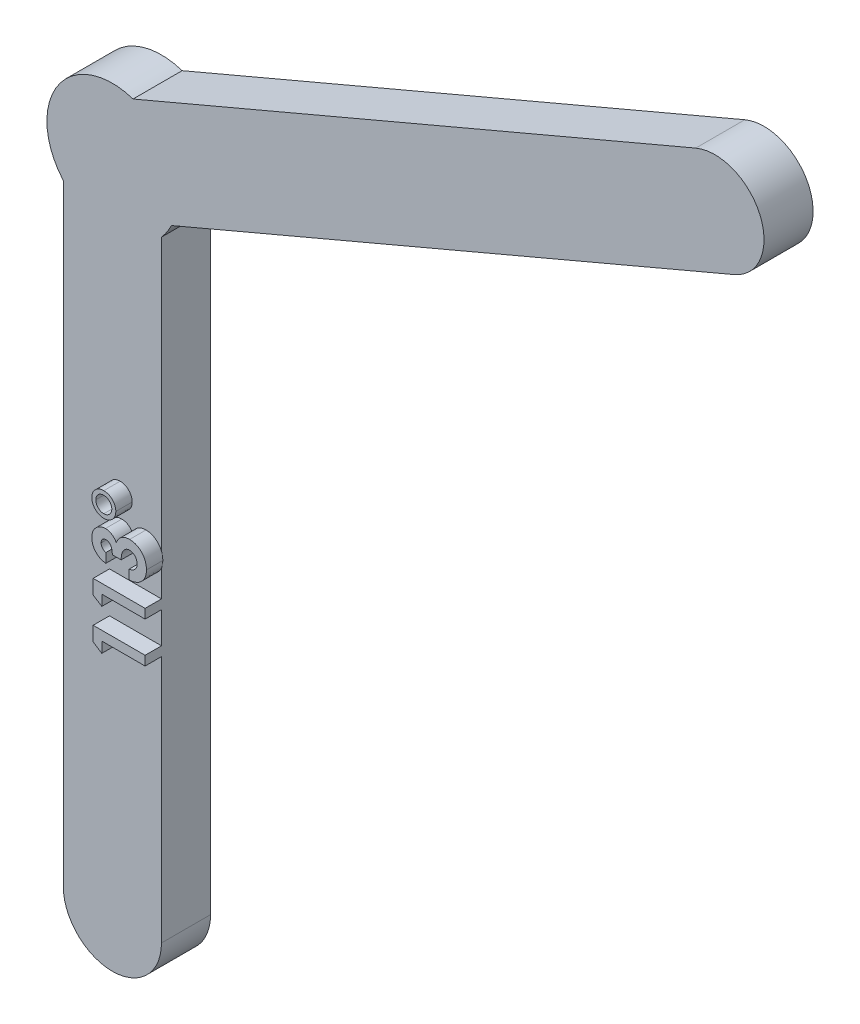
from build123d import *

# Parameters (mm, degrees)
BOSS_EXTRUDE1_DEPTH = 3
BOSS_EXTRUDE2_DEPTH = 1


with BuildPart() as part:
    # Sketch2 → Boss-Extrude1 (new body)
    with BuildSketch(Plane.XY):
        with BuildLine():
            Line((-3, -40), (-3, -2.645751311))
            ThreePointArc((-3, -2.645751311), (-3.335543288, 2.207747941), (1.263233537, 3.795291956))
            Line((1.263233537, 3.795291956), (35.648000753, 18.3907597))
            ThreePointArc((35.648000753, 18.3907597), (39.581708698, 16.801438525), (37.992387524, 12.867730579))
            Line((37.992387524, 12.867730579), (3.607620308, -1.727737165))
            ThreePointArc((3.607620308, -1.727737165), (3.335543288, -2.207747941), (3, -2.645751311))
            Line((3, -2.645751311), (3, -40))
            ThreePointArc((3, -40), (0, -43), (-3, -40))
        make_face()
    extrude(amount=BOSS_EXTRUDE1_DEPTH)

    # Sketch3 → Boss-Extrude2 (add)
    # profile 1 of 4: a face of its own
    with BuildSketch(Plane.XY.offset(3)):
        Polygon((-0.175, -25.154881865), (-0.175, -24.27399745), (3, -24.27399745), (3, -24.843869245), (0.354166667, -24.843869245), (0.354166667, -25.495151297), align=None)
    # profile 2 of 4: a face of its own
    with BuildSketch(Plane.XY.offset(3)):
        Polygon((-0.175, -22.671869045), (-0.175, -21.79098463), (3, -21.79098463), (3, -22.360856425), (0.354166667, -22.360856425), (0.354166667, -23.012138476), align=None)
    # profile 3 of 4: a face of its own
    with BuildSketch(Plane.XY.offset(3)):
        with BuildLine():
            Line((0.598397436, -20.040664117), (0.598397436, -20.610535912))
            add(Edge.make_bspline(
                [(0.598397436, -20.610535912), (0.569905344, -20.6065375), (0.514253238, -20.598727612), (0.433490113, -20.57952876), (0.35669034, -20.557326452), (0.284266078, -20.52893284), (0.216295401, -20.496157537), (0.152717485, -20.457937086), (0.092619933, -20.41604494), (0.05660533, -20.383246008), (0.038701923, -20.36694116)],
                knots=[0, 0, 0, 0, 1.1115466, 2.171125598, 3.205689823, 4.19946166, 5.17440286, 6.118867946, 7.064860634, 8, 8, 8, 8], degree=3))
            add(Edge.make_bspline(
                [(0.038701923, -20.36694116), (0.015043155, -20.343481578), (-0.031585791, -20.297245207), (-0.09131232, -20.219978808), (-0.14300157, -20.138989352), (-0.18398118, -20.052652561), (-0.217149428, -19.9623119), (-0.239428614, -19.867248948), (-0.254211051, -19.767852168), (-0.255667173, -19.70002637), (-0.256410256, -19.665413716)],
                knots=[0, 0, 0, 0, 1.01925491, 2.00884431, 2.983262333, 3.955970413, 4.92937149, 5.924503185, 6.940838805, 8, 8, 8, 8], degree=3))
            add(Edge.make_bspline(
                [(-0.256410256, -19.665413716), (-0.25568378, -19.634641286), (-0.254255673, -19.574148889), (-0.242791605, -19.485240286), (-0.222684907, -19.400473373), (-0.19639585, -19.31895214), (-0.160625195, -19.241875498), (-0.119103078, -19.167542291), (-0.068174475, -19.098029392), (-0.01063028, -19.033174153), (0.0516094, -18.973592246), (0.1181385, -18.921994054), (0.187179874, -18.877634163), (0.259307125, -18.841087479), (0.3346423, -18.812988046), (0.4127502, -18.793486207), (0.493458473, -18.780721779), (0.548314798, -18.779450108), (0.576136819, -18.778805143)],
                knots=[0, 0, 0, 0, 1.091422571, 2.145516843, 3.172569842, 4.178562979, 5.178154469, 6.181868002, 7.194278174, 8.227918432, 9.254613415, 10.245994977, 11.209837596, 12.161663635, 13.10878368, 14.055455738, 15.013766427, 16, 16, 16, 16], degree=3))
            add(Edge.make_bspline(
                [(0.576136819, -18.778805143), (0.610585958, -18.780154134), (0.678613472, -18.782818018), (0.777980899, -18.803885435), (0.8727781, -18.837752509), (0.961881861, -18.885906469), (1.045199363, -18.946377323), (1.1198207, -19.020533365), (1.186901514, -19.106305195), (1.222951204, -19.170693461), (1.241411258, -19.203664918)],
                knots=[0, 0, 0, 0, 0.992776698, 1.96045919, 2.915875678, 3.886951799, 4.871409521, 5.874469288, 6.911574252, 8, 8, 8, 8], degree=3))
            add(Edge.make_bspline(
                [(1.241411258, -19.203664918), (1.248840578, -19.181032969), (1.26343886, -19.136562205), (1.292207769, -19.073365106), (1.323580612, -19.013222423), (1.360205051, -18.957509599), (1.399542556, -18.904698842), (1.44370819, -18.856461012), (1.491568291, -18.811547008), (1.543631999, -18.771067945), (1.599033683, -18.734877786), (1.656777581, -18.702983753), (1.717074737, -18.676218665), (1.779482048, -18.65375486), (1.844613707, -18.636615599), (1.912248991, -18.624557508), (1.982224933, -18.617585365), (2.02963392, -18.616522205), (2.053605769, -18.61598463)],
                knots=[0, 0, 0, 0, 1.059375415, 2.081625174, 3.086260357, 4.075579879, 5.045586876, 6.014170127, 6.982201689, 7.963705737, 8.945119069, 9.924852636, 10.896327119, 11.878239286, 12.873838556, 13.889973282, 14.933087432, 16, 16, 16, 16], degree=3))
            add(Edge.make_bspline(
                [(2.053605769, -18.61598463), (2.088834625, -18.617074457), (2.158298755, -18.619223375), (2.260612118, -18.632885524), (2.358159557, -18.658320994), (2.452060019, -18.691786039), (2.541114181, -18.736412521), (2.627316675, -18.78897542), (2.707744153, -18.853314042), (2.783940091, -18.925463773), (2.853551958, -19.005171918), (2.915054815, -19.090943053), (2.965754166, -19.182943356), (3.00908881, -19.278948612), (3.04124993, -19.381121611), (3.064801955, -19.48814067), (3.079131724, -19.600787283), (3.080639979, -19.677667745), (3.081410256, -19.716931144)],
                knots=[0, 0, 0, 0, 1.005228408, 1.982105694, 2.937129188, 3.876607107, 4.82066901, 5.774063015, 6.75178259, 7.752926466, 8.764612432, 9.766578198, 10.757677051, 11.756882247, 12.76686714, 13.807379907, 14.880213281, 16, 16, 16, 16], degree=3))
            add(Edge.make_bspline(
                [(3.081410256, -19.716931144), (3.080599988, -19.754074478), (3.079015615, -19.826703352), (3.065302063, -19.93293828), (3.043180991, -20.033904524), (3.011999506, -20.12985975), (2.971562448, -20.220432716), (2.923410986, -20.306444772), (2.864767854, -20.386179568), (2.798280315, -20.460525505), (2.723685071, -20.527833366), (2.642710085, -20.587990743), (2.555047441, -20.639671156), (2.46107167, -20.683086546), (2.360617912, -20.717897503), (2.253890444, -20.745356284), (2.140680753, -20.764536692), (2.062790077, -20.770378125), (2.023076923, -20.773356425)],
                knots=[0, 0, 0, 0, 1.066544725, 2.085487077, 3.070979577, 4.031932826, 4.977951092, 5.916076795, 6.857635327, 7.814973522, 8.776389752, 9.738577119, 10.707772778, 11.69409279, 12.707140348, 13.757286496, 14.856535458, 16, 16, 16, 16], degree=3))
            Line((2.023076923, -20.773356425), (2.023076923, -20.20348463))
            add(Edge.make_bspline(
                [(2.023076923, -20.20348463), (2.043044885, -20.199872708), (2.081937728, -20.192837541), (2.138251456, -20.179128289), (2.190212049, -20.161216234), (2.23820125, -20.14073744), (2.282711557, -20.11809573), (2.322552685, -20.091042811), (2.359290392, -20.06203608), (2.401517912, -20.018432355), (2.445802396, -19.957595168), (2.485022762, -19.875225195), (2.507328862, -19.783178402), (2.510104057, -19.718959072), (2.511538462, -19.685766281)],
                knots=[0, 0, 0, 0, 0.928450228, 1.808400301, 2.64896863, 3.43999153, 4.194978884, 4.9294959, 5.640047715, 6.332896648, 7.70085756, 9.063442004, 10.482192841, 12, 12, 12, 12], degree=3))
            add(Edge.make_bspline(
                [(2.511538462, -19.685766281), (2.511234698, -19.668150574), (2.510639692, -19.633645346), (2.504104723, -19.582949367), (2.493216621, -19.534703782), (2.478821118, -19.48850793), (2.4592865, -19.445087794), (2.436616641, -19.403460265), (2.4088653, -19.364386621), (2.377245282, -19.328094482), (2.343480924, -19.294318614), (2.306533866, -19.265477934), (2.268178179, -19.240578335), (2.227399343, -19.220930875), (2.185484675, -19.204487167), (2.141101944, -19.194231482), (2.095214543, -19.18653442), (2.063816677, -19.186084678), (2.047881611, -19.185856425)],
                knots=[0, 0, 0, 0, 1.110702965, 2.175618623, 3.217100552, 4.227908035, 5.221854906, 6.215531843, 7.213608581, 8.237687243, 9.249555755, 10.220750668, 11.188994735, 12.127982202, 13.071814005, 14.022160605, 14.996205625, 16, 16, 16, 16], degree=3))
            add(Edge.make_bspline(
                [(2.047881611, -19.185856425), (2.030448232, -19.186436866), (1.995950897, -19.187585449), (1.945396706, -19.197692925), (1.896579334, -19.212822325), (1.849901563, -19.23458121), (1.80563791, -19.26305368), (1.763421781, -19.297673283), (1.723589285, -19.338753198), (1.684980341, -19.384917769), (1.651182253, -19.438029654), (1.620059269, -19.495944113), (1.595277703, -19.560087916), (1.57314858, -19.628922244), (1.556984463, -19.703741346), (1.545248131, -19.784082878), (1.536512134, -19.869816579), (1.535258821, -19.928913962), (1.534615385, -19.959253861)],
                knots=[0, 0, 0, 0, 0.809868251, 1.602574917, 2.388262527, 3.182133002, 3.988875265, 4.829537611, 5.714850619, 6.646378958, 7.622533229, 8.636771727, 9.698525113, 10.814716514, 11.996253919, 13.252421425, 14.589425562, 16, 16, 16, 16], degree=3))
            Line((1.534615385, -19.959253861), (1.005448718, -19.959253861))
            add(Edge.make_bspline(
                [(1.005448718, -19.959253861), (1.0022437, -19.921474277), (0.996247747, -19.850796158), (0.982028627, -19.752758608), (0.963634458, -19.669942608), (0.939661871, -19.601401551), (0.911660162, -19.543547033), (0.879215485, -19.49371525), (0.841958845, -19.450238513), (0.799944528, -19.414477082), (0.755904956, -19.384675192), (0.709066574, -19.364274226), (0.661292945, -19.350600053), (0.628592786, -19.349314119), (0.612389824, -19.348676938)],
                knots=[0, 0, 0, 0, 1.700711886, 3.181695139, 4.441392523, 5.500267777, 6.431839453, 7.31822765, 8.161090383, 8.990537424, 9.787217293, 10.536619396, 11.274893404, 12, 12, 12, 12], degree=3))
            add(Edge.make_bspline(
                [(0.612389824, -19.348676938), (0.591714502, -19.349771701), (0.551360652, -19.351908447), (0.493502791, -19.368829048), (0.441654003, -19.397544009), (0.396394238, -19.436505634), (0.359475255, -19.484370414), (0.332017035, -19.539765179), (0.315998921, -19.602409235), (0.314326488, -19.646451846), (0.313461538, -19.669229822)],
                knots=[0, 0, 0, 0, 1.009324788, 1.969988301, 2.915956825, 3.885795408, 4.868116622, 5.850437836, 6.888288533, 8, 8, 8, 8], degree=3))
            add(Edge.make_bspline(
                [(0.313461538, -19.669229822), (0.314477881, -19.68987794), (0.316494615, -19.730850129), (0.331546985, -19.790763733), (0.356885777, -19.847661695), (0.391826478, -19.900365821), (0.433788778, -19.948115314), (0.483484413, -19.987303871), (0.537936031, -20.019899055), (0.578164626, -20.033715295), (0.598397436, -20.040664117)],
                knots=[0, 0, 0, 0, 0.98818071, 1.960853194, 2.938124878, 3.957524365, 4.978590984, 5.968022688, 6.978025184, 8, 8, 8, 8], degree=3))
        make_face()
    # profile 4 of 4: a face of its own
    with BuildSketch(Plane.XY.offset(3)):
        with BuildLine():
            add(Edge.make_bspline(
                [(0.476282051, -16.824958989), (0.501543872, -16.825505484), (0.55122174, -16.826580176), (0.624352745, -16.837013476), (0.694208258, -16.854492691), (0.761803607, -16.876903338), (0.825395964, -16.908042089), (0.886396731, -16.944903837), (0.943669883, -16.989402672), (0.9978957, -17.039014969), (1.047295391, -17.093515132), (1.090947065, -17.151405488), (1.127096601, -17.212864468), (1.157366856, -17.276577248), (1.180332148, -17.343408663), (1.196689885, -17.412864586), (1.20741609, -17.485236986), (1.208449037, -17.534503871), (1.208974359, -17.559559349)],
                knots=[0, 0, 0, 0, 1.048753193, 2.062393874, 3.059725798, 4.03711221, 5.013824111, 5.993903926, 6.992478922, 8.020738441, 9.043061753, 10.043343452, 11.026424807, 11.999358773, 12.968420071, 13.955122655, 14.960044262, 16, 16, 16, 16], degree=3))
            add(Edge.make_bspline(
                [(1.208974359, -17.559559349), (1.208454225, -17.584616682), (1.207431478, -17.633887214), (1.196631189, -17.706233128), (1.180530583, -17.775855144), (1.156529218, -17.842391691), (1.126678292, -17.90615653), (1.090260147, -17.967072817), (1.046482503, -18.024600993), (0.996781055, -18.078582797), (0.942375086, -18.128107638), (0.88420218, -18.171482912), (0.823225465, -18.208946116), (0.758107997, -18.237837437), (0.69067286, -18.261947038), (0.619758864, -18.27798784), (0.545943315, -18.288833106), (0.495615647, -18.289833085), (0.469921875, -18.290343604)],
                knots=[0, 0, 0, 0, 1.037227242, 2.039512271, 3.023626077, 3.993053151, 4.963434463, 5.936395473, 6.927031705, 7.952593414, 8.972234493, 9.969891786, 10.954906455, 11.929570282, 12.915563215, 13.916770353, 14.936449251, 16, 16, 16, 16], degree=3))
            add(Edge.make_bspline(
                [(0.469921875, -18.290343604), (0.445290866, -18.289811451), (0.396869022, -18.288765297), (0.325492116, -18.278103661), (0.256787066, -18.261182775), (0.190979117, -18.23681523), (0.128167681, -18.205730248), (0.067236284, -18.169180135), (0.010175979, -18.123937412), (-0.044275745, -18.073515722), (-0.093962638, -18.018218509), (-0.137555056, -17.95952238), (-0.173973759, -17.89802202), (-0.203993097, -17.834134423), (-0.227847104, -17.767768562), (-0.244158222, -17.698411219), (-0.254789074, -17.626671533), (-0.255866772, -17.577830012), (-0.256410256, -17.553199173)],
                knots=[0, 0, 0, 0, 1.027628768, 2.020204677, 3.0054932, 3.977172113, 4.942988595, 5.928118098, 6.937247537, 7.976812879, 9.023474825, 10.036014018, 11.024160528, 12.002107364, 12.979092523, 13.962271943, 14.972371232, 16, 16, 16, 16], degree=3))
            add(Edge.make_bspline(
                [(-0.256410256, -17.553199173), (-0.255881051, -17.528566172), (-0.254836181, -17.479930408), (-0.244068832, -17.408427146), (-0.227959354, -17.339440503), (-0.203981879, -17.27352423), (-0.173948227, -17.210285117), (-0.137706982, -17.149501332), (-0.093944483, -17.091941849), (-0.043999627, -17.038019265), (0.009956511, -16.987787182), (0.068273488, -16.944627592), (0.128824771, -16.907104674), (0.192846684, -16.877455064), (0.259342082, -16.853394895), (0.329176204, -16.837233977), (0.401748506, -16.826543556), (0.451226198, -16.825491671), (0.476282051, -16.824958989)],
                knots=[0, 0, 0, 0, 1.02774298, 2.029191086, 3.012479778, 3.981238486, 4.951290381, 5.931946007, 6.930416638, 7.964088953, 8.997761269, 10.003308488, 10.98854748, 11.966603007, 12.943696749, 13.935593372, 14.954569896, 16, 16, 16, 16], degree=3))
        make_face()
        with BuildLine():
            add(Edge.make_bspline(
                [(0.479462139, -17.069189758), (0.462471258, -17.069424264), (0.428972226, -17.069886612), (0.379883793, -17.077505977), (0.332524379, -17.088023775), (0.287283463, -17.10328392), (0.24427911, -17.123234284), (0.203398935, -17.147571829), (0.164484674, -17.176174899), (0.128492582, -17.209237523), (0.095853701, -17.245103846), (0.066652511, -17.282897251), (0.042455186, -17.323086522), (0.023016589, -17.365273093), (0.006315159, -17.408801858), (-0.003707976, -17.454711924), (-0.01154919, -17.502263298), (-0.011966436, -17.534718897), (-0.012179487, -17.55129112)],
                knots=[0, 0, 0, 0, 1.061159961, 2.092171217, 3.098605391, 4.092036902, 5.070589041, 6.057187883, 7.061962211, 8.084674938, 9.107387665, 10.090954379, 11.06617917, 12.032717429, 12.99305519, 13.973669989, 14.965331307, 16, 16, 16, 16], degree=3))
            add(Edge.make_bspline(
                [(-0.012179487, -17.55129112), (-0.01157068, -17.568051412), (-0.01036426, -17.601263796), (-0.004409395, -17.650200831), (0.007572839, -17.69685371), (0.022606002, -17.742054962), (0.043122897, -17.784898142), (0.067542797, -17.826391236), (0.096744971, -17.865435361), (0.129769422, -17.902214665), (0.165718261, -17.935960463), (0.204573602, -17.964950546), (0.244977971, -17.990352408), (0.287582445, -18.010455361), (0.331832846, -18.026567734), (0.377821945, -18.038209426), (0.425871214, -18.044356322), (0.458458137, -18.045521173), (0.475010016, -18.046112835)],
                knots=[0, 0, 0, 0, 1.042034071, 2.064906527, 3.055369705, 4.030203466, 5.020228521, 6.000742353, 7.017744738, 8.043920206, 9.069249762, 10.075703201, 11.051782302, 12.029903876, 12.99669358, 13.974371501, 14.971122288, 16, 16, 16, 16], degree=3))
            add(Edge.make_bspline(
                [(0.475010016, -18.046112835), (0.491349767, -18.045520146), (0.523514051, -18.044353455), (0.570936909, -18.038223162), (0.616468237, -18.026465839), (0.660506807, -18.010425399), (0.703332854, -17.990458383), (0.743356347, -17.964229259), (0.782721478, -17.935019181), (0.819574977, -17.900938323), (0.853594861, -17.864058718), (0.883277913, -17.824563201), (0.908722399, -17.783622403), (0.929101491, -17.740636346), (0.945194342, -17.696373754), (0.956841315, -17.650387952), (0.962986781, -17.60233779), (0.964151827, -17.56975099), (0.96474359, -17.553199173)],
                knots=[0, 0, 0, 0, 1.017878107, 2.003660885, 2.970612419, 3.939454555, 4.919652619, 5.904816436, 6.913406512, 7.969270601, 9.02513469, 10.033724766, 11.041277553, 12.021475617, 12.990317753, 13.970071221, 14.968938047, 16, 16, 16, 16], degree=3))
            add(Edge.make_bspline(
                [(0.96474359, -17.553199173), (0.964515736, -17.536840687), (0.964066668, -17.504600367), (0.956359019, -17.457448889), (0.946146284, -17.411789288), (0.929505189, -17.368485652), (0.910263551, -17.326033898), (0.884925795, -17.286252494), (0.856415485, -17.247396305), (0.822504018, -17.212069657), (0.787116244, -17.177952839), (0.747777121, -17.149765554), (0.707718654, -17.124520148), (0.665616684, -17.10387006), (0.621397497, -17.089062601), (0.575848465, -17.07693948), (0.528165265, -17.071009446), (0.49579822, -17.069800121), (0.479462139, -17.069189758)],
                knots=[0, 0, 0, 0, 1.029744634, 2.029484694, 3.00508751, 3.97324883, 4.947661161, 5.937798898, 6.940036528, 7.980134083, 9.020231638, 10.033191535, 11.023329272, 12.003497406, 12.979740652, 13.958541426, 14.969648588, 16, 16, 16, 16], degree=3))
        make_face(mode=Mode.SUBTRACT)
    extrude(amount=BOSS_EXTRUDE2_DEPTH)


solid = part.part
